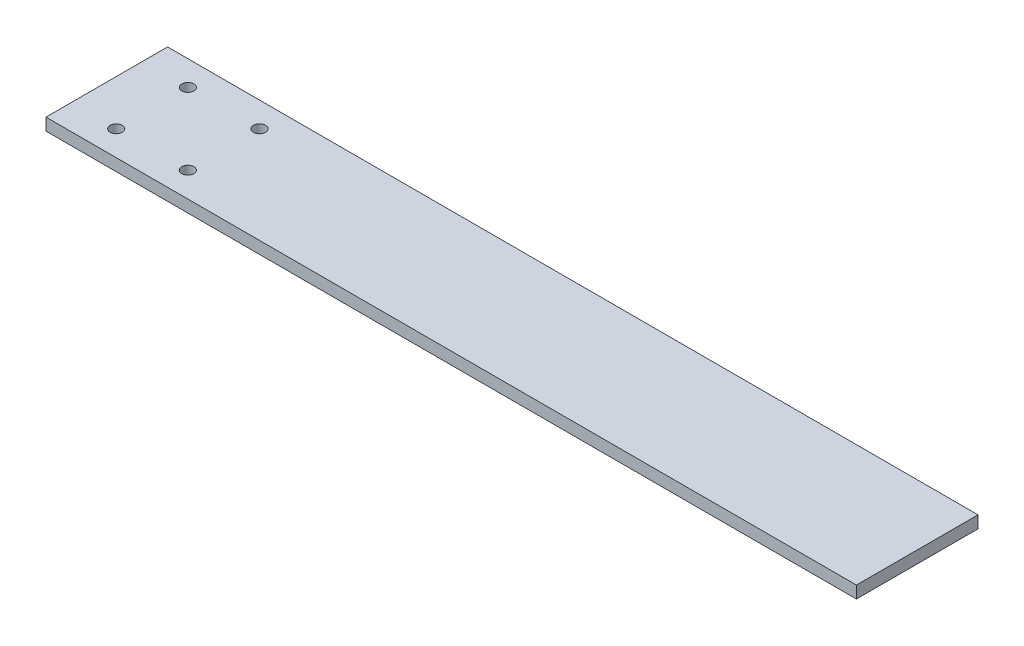
from build123d import *

# Parameters (mm, degrees)
SKETCH1_W           = 200
SKETCH1_H           = 30
SKETCH1_R           = 1.5
BOSS_EXTRUDE1_DEPTH = 3


with BuildPart() as part:
    # Sketch1 → Boss-Extrude1 (new body)
    with BuildSketch(Plane(origin=(0, 0, 0), x_dir=(1, 0, 0), z_dir=(0, 1, 0))):
        Rectangle(SKETCH1_W, SKETCH1_H)
        with Locations(Location((-88.838834765, -8.838834765, 0), (0, 0, 270))):
            Circle(SKETCH1_R, mode=Mode.SUBTRACT)
        with Locations(Location((-88.838834765, 8.838834765, 0), (0, 0, 270))):
            Circle(SKETCH1_R, mode=Mode.SUBTRACT)
        with Locations(Location((-71.161165235, 8.838834765, 0), (0, 0, 270))):
            Circle(SKETCH1_R, mode=Mode.SUBTRACT)
        with Locations(Location((-71.161165235, -8.838834765, 0), (0, 0, 270))):
            Circle(SKETCH1_R, mode=Mode.SUBTRACT)
    extrude(amount=BOSS_EXTRUDE1_DEPTH)


solid = part.part
